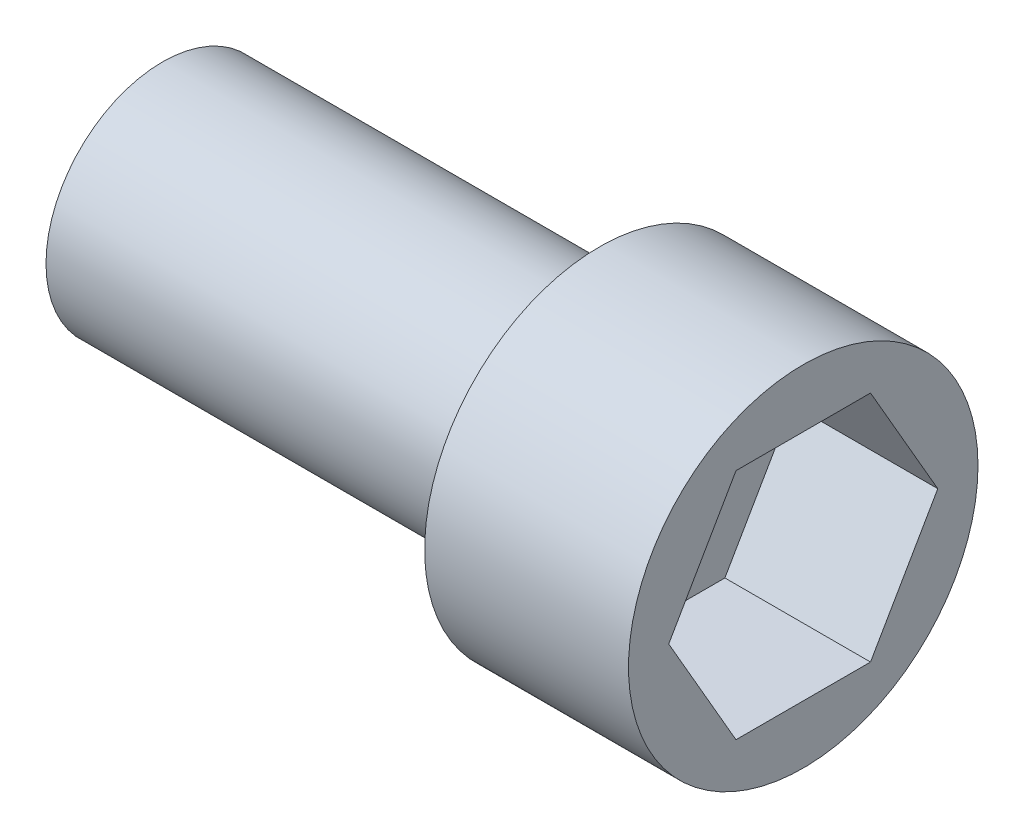
from build123d import *

# Parameters (mm, degrees)
CUT_EXTRUDE1_DEPTH = 5


with BuildPart() as part:
    # Sketch1 → Revolve2 (revolve)
    with BuildSketch(Plane.XY, mode=Mode.PRIVATE) as revolve2_sk:
        Polygon((0, 0), (0, 4), (15, 4), (15, 6), (22, 6), (22, 0), align=None)
    revolve(revolve2_sk.sketch.rotate(Axis((22, 0, 0), (-1, 0, 0)), 90), axis=Axis((22, 0, 0), (-1, 0, 0)))

    # Sketch2 → Cut-Extrude1 (cut)
    with BuildSketch(Plane(origin=(22, 0, 0), x_dir=(0, 0, -1), z_dir=(1, 0, 0))):
        Polygon((4.618802154, 0), (2.309401077, 4), (-2.309401077, 4), (-4.618802154, 0), (-2.309401077, -4), (2.309401077, -4), align=None)
    extrude(amount=-CUT_EXTRUDE1_DEPTH, mode=Mode.SUBTRACT)


solid = part.part
